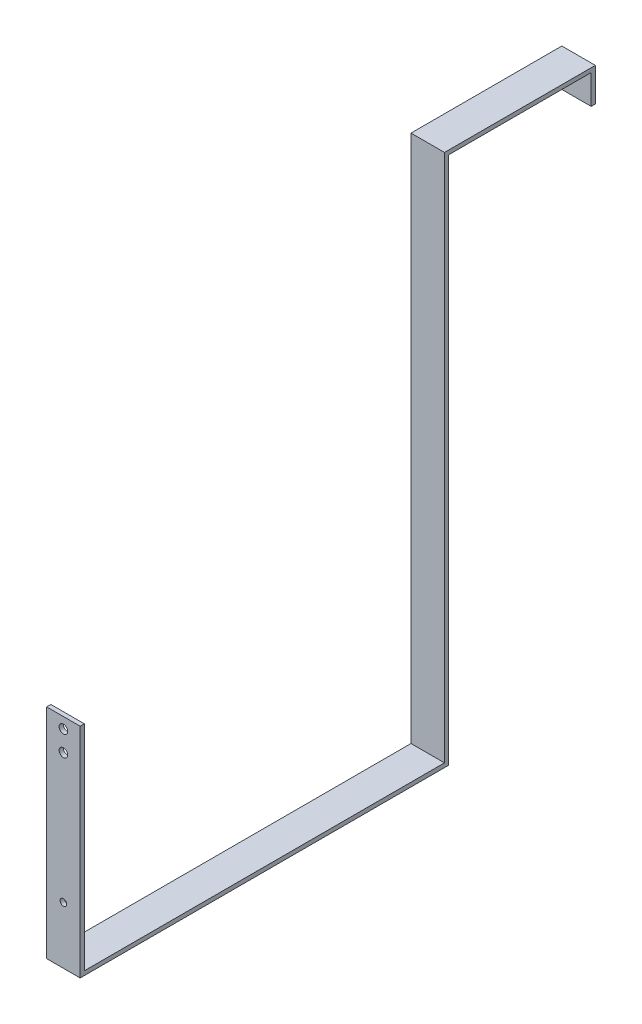
from build123d import *

# Parameters (mm, degrees)
CROQUIS1_W              = 50.8
CROQUIS1_H              = 6.31
SALIENTE_EXTRUIR1_DEPTH = 228.75
CROQUIS2_W              = 50.8
CROQUIS2_H              = 6.31
SALIENTE_EXTRUIR2_DEPTH = 801.67
CROQUIS3_W              = 50.8
CROQUIS3_H              = 6.31
SALIENTE_EXTRUIR3_DEPTH = 552.5
CROQUIS4_W              = 50.8
CROQUIS4_H              = 6.31
SALIENTE_EXTRUIR4_DEPTH = 314.39
CROQUIS6_W              = 50.8
CROQUIS6_H              = 6.31
SALIENTE_EXTRUIR5_DEPTH = 10
CROQUIS7_W              = 50.8
CROQUIS7_H              = 6.31
SALIENTE_EXTRUIR6_DEPTH = 50.8
CROQUIS12_R             = 6.5
CORTAR_EXTRUIR3_DEPTH   = 10
CROQUIS13_R             = 5
CORTAR_EXTRUIR4_DEPTH   = 35


with BuildPart() as part:
    # Croquis1 → Saliente-Extruir1 (new body)
    with BuildSketch(Plane.XY):
        Rectangle(CROQUIS1_W, CROQUIS1_H)
    extrude(amount=SALIENTE_EXTRUIR1_DEPTH)

    # Croquis2 → Saliente-Extruir2 (add)
    with BuildSketch(Plane.XZ.offset(3.155)):
        with Locations((0, 225.595)):
            Rectangle(CROQUIS2_W, CROQUIS2_H)
    extrude(amount=SALIENTE_EXTRUIR2_DEPTH)

    # Croquis3 → Saliente-Extruir3 (add)
    with BuildSketch(Plane.XY.offset(228.75)):
        with Locations((0, -801.67)):
            Rectangle(CROQUIS3_W, CROQUIS3_H)
    extrude(amount=SALIENTE_EXTRUIR3_DEPTH)

    # Croquis4 → Saliente-Extruir4 (add)
    with BuildSketch(Plane(origin=(0, -798.515, 0), x_dir=(1, 0, 0), z_dir=(0, 1, 0))):
        with Locations((0, -778.095)):
            Rectangle(CROQUIS4_W, CROQUIS4_H)
    extrude(amount=SALIENTE_EXTRUIR4_DEPTH)

    # Croquis6 → Saliente-Extruir5 (add)
    with BuildSketch(Plane(origin=(0, -484.125, 0), x_dir=(1, 0, 0), z_dir=(0, 1, 0))):
        with Locations((0, -778.095)):
            Rectangle(CROQUIS6_W, CROQUIS6_H)
    extrude(amount=SALIENTE_EXTRUIR5_DEPTH)

    # Croquis7 → Saliente-Extruir6 (add)
    with BuildSketch(Plane(origin=(0, 3.155, 0), x_dir=(1, 0, 0), z_dir=(0, 1, 0))):
        with Locations((0, -3.155)):
            Rectangle(CROQUIS7_W, CROQUIS7_H)
    extrude(amount=-SALIENTE_EXTRUIR6_DEPTH)

    # Croquis12 → Cortar-Extruir3 (cut)
    with BuildSketch(Plane.XY.offset(781.25)):
        with Locations((0, -521.625)):
            Circle(CROQUIS12_R)
        with Locations((0, -490.625)):
            Circle(CROQUIS12_R)
    extrude(amount=-CORTAR_EXTRUIR3_DEPTH, mode=Mode.SUBTRACT)

    # Croquis13 → Cortar-Extruir4 (cut)
    with BuildSketch(Plane.XY.offset(781.25)):
        with Locations((0, -718.315)):
            Circle(CROQUIS13_R)
    extrude(amount=-CORTAR_EXTRUIR4_DEPTH, mode=Mode.SUBTRACT)


solid = part.part
